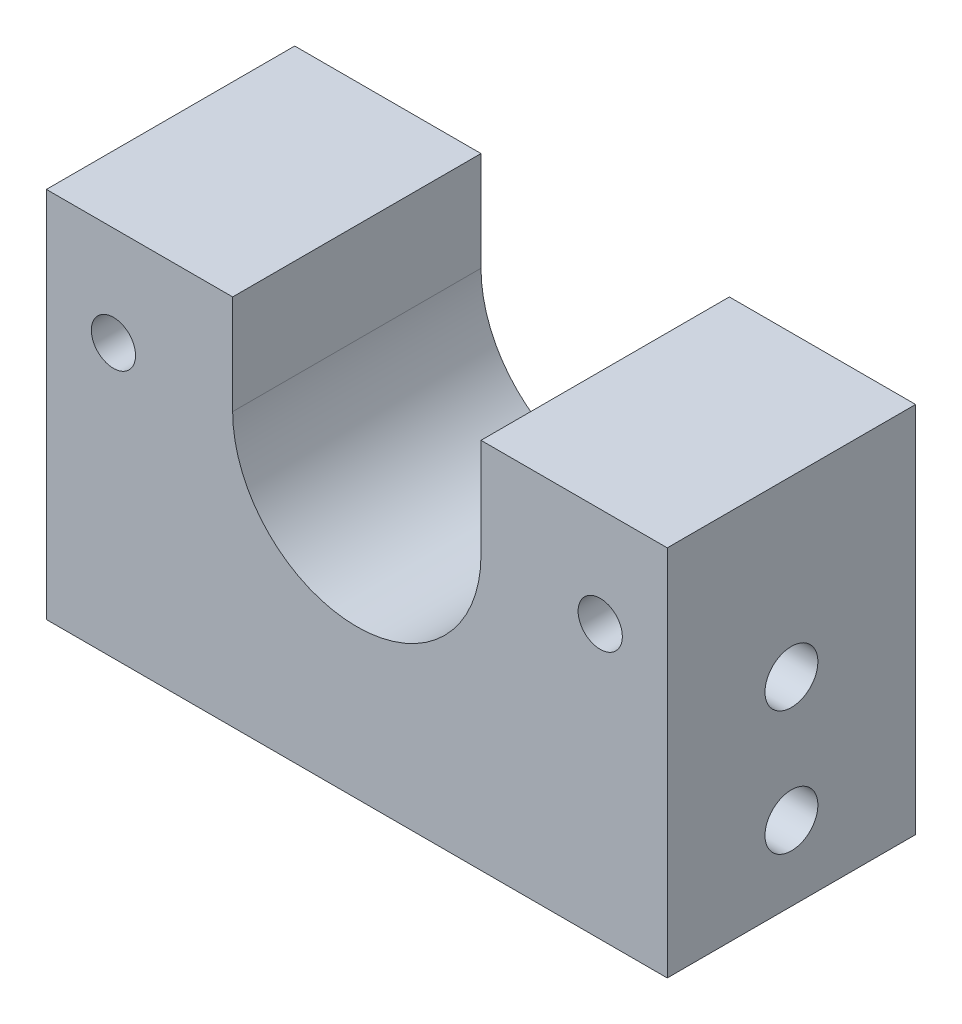
from build123d import *

# Parameters (mm, degrees)
SKETCH1_W                 = 12.7
SKETCH1_H                 = 19.05
BASE_DEPTH                = 31.75
MOTORSLOT_DEPTH           = 40.144028919
MOTORHOLES_D              = 2.2606
F_6_32_TAPPED_HOLE1_D     = 2.7051
F_6_32_TAPPED_HOLE1_DEPTH = 8.382
F_6_32_TAPPED_HOLE1_TIP   = 0.81269403


with BuildPart() as part:
    # Sketch1 → Base (new body)
    with BuildSketch(Plane(origin=(0, 0, 0), x_dir=(0, 0, -1), z_dir=(1, 0, 0))):
        with Locations((6.35, 9.525)):
            Rectangle(SKETCH1_W, SKETCH1_H)
    extrude(amount=-BASE_DEPTH)

    # Sketch5 → MotorSlot (cut, through all)
    with BuildSketch(Plane(origin=(0, 0, -12.7), x_dir=(-1, 0, 0), z_dir=(0, 0, -1))):
        with BuildLine():
            Line((22.225, 19.05), (22.225, 13.97))
            ThreePointArc((22.225, 13.97), (15.875, 7.62), (9.525, 13.97))
            Line((9.525, 13.97), (9.525, 19.05))
            ThreePointArc((9.525, 19.05), (15.875, 25.4), (22.225, 19.05))
        make_face()
    extrude(amount=-MOTORSLOT_DEPTH, mode=Mode.SUBTRACT)

    # MotorHoles (through all)
    with Locations(Plane(origin=(0, 0, -12.7), x_dir=(-1, 0, 0), z_dir=(0, 0, -1))):
        with Locations((3.429, 13.97), (28.321, 13.97)):
            Hole(MOTORHOLES_D / 2)

    # #6-32 Tapped Hole1
    with Locations(Plane(origin=(0, 0, 0), x_dir=(0, 0, -1), z_dir=(1, 0, 0))):
        with Locations((6.35, 3.81), (6.35, 10.16)):
            Hole(F_6_32_TAPPED_HOLE1_D / 2, depth=F_6_32_TAPPED_HOLE1_DEPTH)
            with Locations((0, 0, -(F_6_32_TAPPED_HOLE1_DEPTH + F_6_32_TAPPED_HOLE1_TIP / 2))):  # 118° drill point
                Cone(0, F_6_32_TAPPED_HOLE1_D / 2, F_6_32_TAPPED_HOLE1_TIP, mode=Mode.SUBTRACT)


solid = part.part
